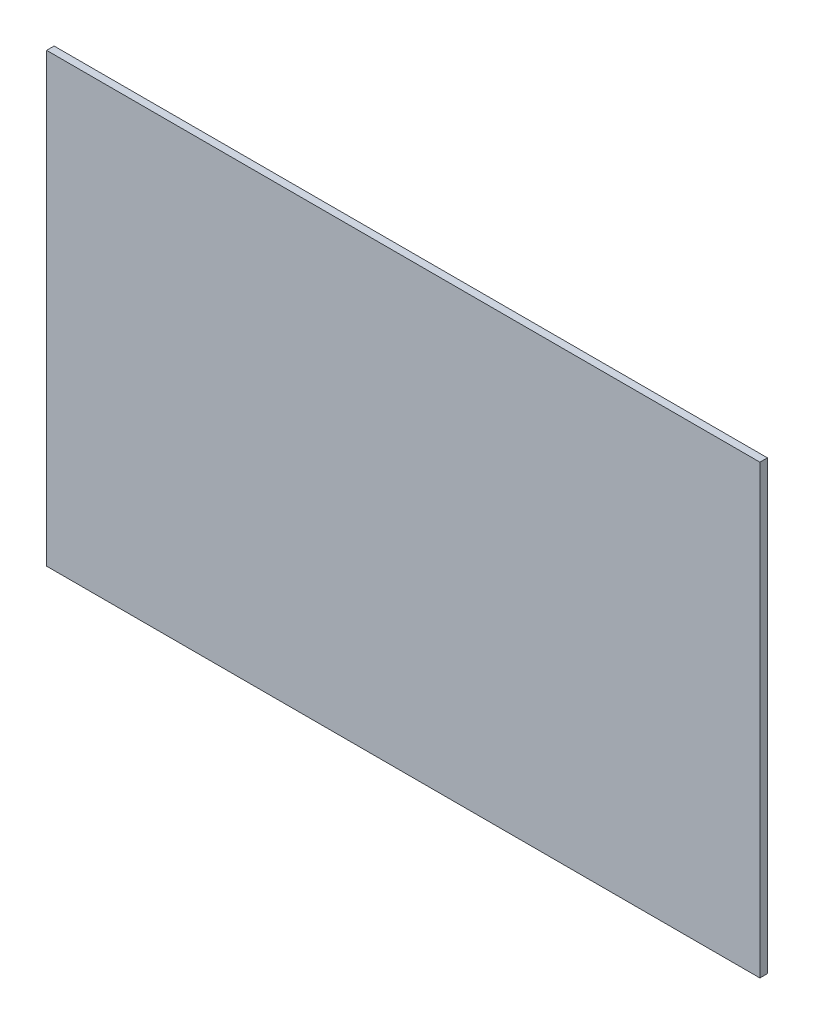
from build123d import *

# Parameters (mm, degrees)
SKETCH_1_W      = 950
SKETCH_1_H      = 595
EXTRUDE_1_DEPTH = 10


with BuildPart() as part:
    # Эскиз1 → Бобышка-Вытянуть1 (new body)
    with BuildSketch(Plane.XY):
        Rectangle(SKETCH_1_W, SKETCH_1_H)
    extrude(amount=EXTRUDE_1_DEPTH)


solid = part.part
